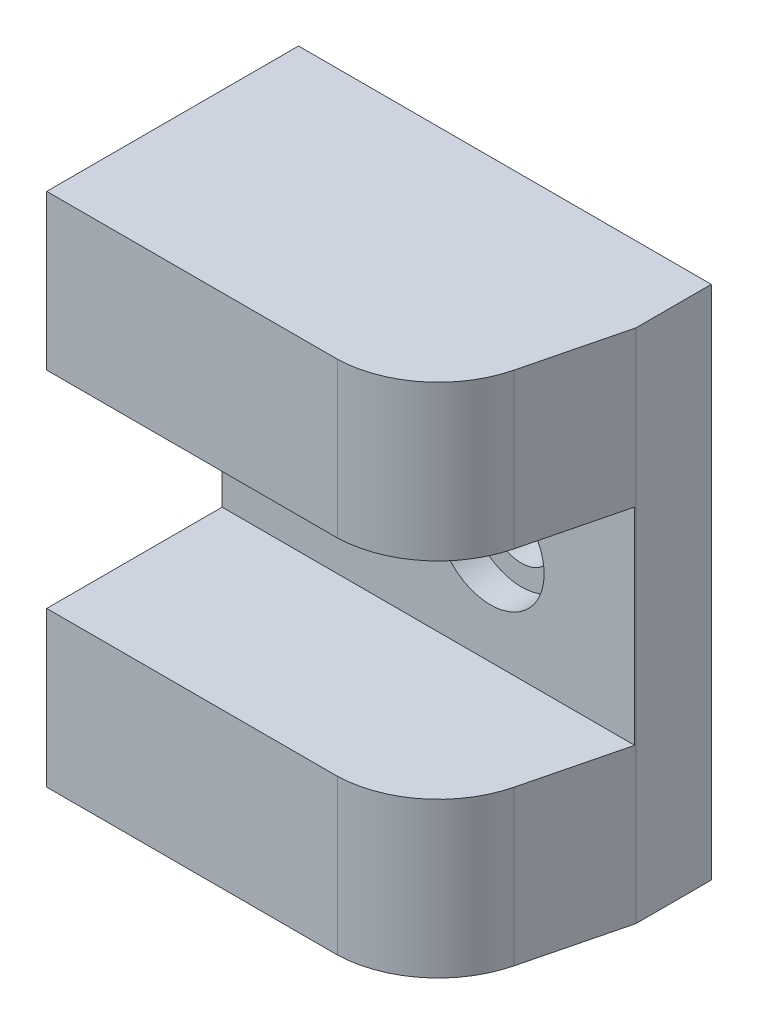
from build123d import *

# Parameters (mm, degrees)
SKETCH_1_W                   = 20
SKETCH_1_H                   = 25
EXTRUDE_1_DEPTH              = 12.2
CUT_EXTRUDE_1_DEPTH          = 26.5
SKETCH_3_W                   = 20
SKETCH_3_H                   = 10
CUT_EXTRUDE_2_DEPTH          = 8.5
HOLE_WIZARD_M3_1_D           = 3.2
HOLE_WIZARD_M3_1_CBORE_D     = 5.2
HOLE_WIZARD_M3_1_CBORE_DEPTH = 1.5


with BuildPart() as part:
    # 草图1 → 凸台-拉伸1 (new body)
    with BuildSketch(Plane.XY):
        with Locations((120, 92.5)):
            Rectangle(SKETCH_1_W, SKETCH_1_H)
    extrude(amount=EXTRUDE_1_DEPTH)

    # 草图2 → 切除-拉伸1 (cut)
    with BuildSketch(Plane(origin=(0, 105, 0), x_dir=(1, 0, 0), z_dir=(0, 1, 0))):
        with BuildLine():
            Line((128.820028656, -8.384331601), (130, -3.651725034))
            Line((130, -3.651725034), (130, -12.2))
            Line((130, -12.2), (124.083012976, -12.2))
            ThreePointArc((124.083012976, -12.2), (127.092624303, -11.088072823), (128.820028656, -8.384331601))
        make_face()
    extrude(amount=-CUT_EXTRUDE_1_DEPTH, mode=Mode.SUBTRACT)

    # 草图3 → 切除-拉伸2 (cut)
    with BuildSketch(Plane.XY.offset(12.2)):
        with Locations((120, 92.5)):
            Rectangle(SKETCH_3_W, SKETCH_3_H)
    extrude(amount=-CUT_EXTRUDE_2_DEPTH, mode=Mode.SUBTRACT)

    # M3 六角头螺栓的柱形沉头孔1 (through all)
    with Locations(Plane.XY.offset(3.7)):
        with Locations((115, 92.5), (123, 92.5)):
            CounterBoreHole(HOLE_WIZARD_M3_1_D / 2, HOLE_WIZARD_M3_1_CBORE_D / 2, HOLE_WIZARD_M3_1_CBORE_DEPTH)


solid = part.part
